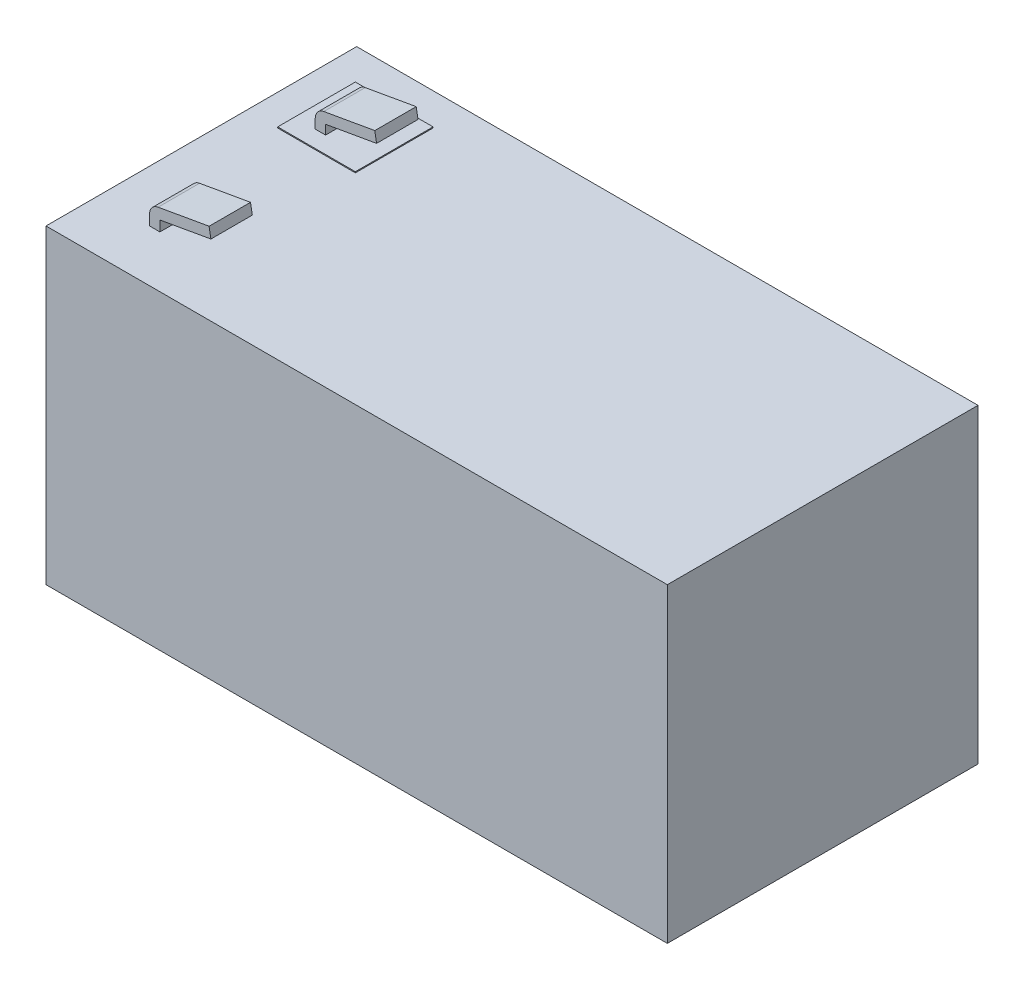
from build123d import *

# Parameters (mm, degrees)
SKETCH1_W           = 152.4
SKETCH1_H           = 76.2
BOSS_EXTRUDE1_DEPTH = 76.2
SKETCH2_W           = 2.54
SKETCH2_H           = 10.16
SKETCH5_W           = 19.05
SKETCH5_H           = 19.05
BOSS_EXTRUDE2_DEPTH = 0.254


with BuildPart() as part:
    # Sketch1 → Boss-Extrude1 (new body)
    with BuildSketch(Plane(origin=(0, 0, 0), x_dir=(1, 0, 0), z_dir=(0, 1, 0))):
        Rectangle(SKETCH1_W, SKETCH1_H)
    extrude(amount=BOSS_EXTRUDE1_DEPTH)

    # Sweep1: sweep along a path in Sketch4
    with BuildLine(Plane.XY) as sweep1_path:
        Line((-62.23, 76.2), (-62.23, 78.74))
        ThreePointArc((-62.23, 78.74), (-61.932876443, 79.556340264), (-61.180533186, 79.990705846))
        Line((-61.180533186, 79.990705846), (-48.673474722, 82.196037703))
    # Sketch2 → Sweep1 (sweep)
    with BuildSketch(Plane(origin=(0, 76.2, 0), x_dir=(1, 0, 0), z_dir=(0, 1, 0))):
        with Locations((-62.23, 20.32)):
            Rectangle(SKETCH2_W, SKETCH2_H)
        with Locations((-62.23, -20.32)):
            Rectangle(SKETCH2_W, SKETCH2_H)
    sweep(path=sweep1_path.line)

    # Sketch5 → Boss-Extrude2 (add)
    with BuildSketch(Plane(origin=(0, 76.2, 0), x_dir=(1, 0, 0), z_dir=(0, 1, 0))):
        with Locations((-59.055, 20.6375)):
            Rectangle(SKETCH5_W, SKETCH5_H)
    extrude(amount=BOSS_EXTRUDE2_DEPTH)


solid = part.part
